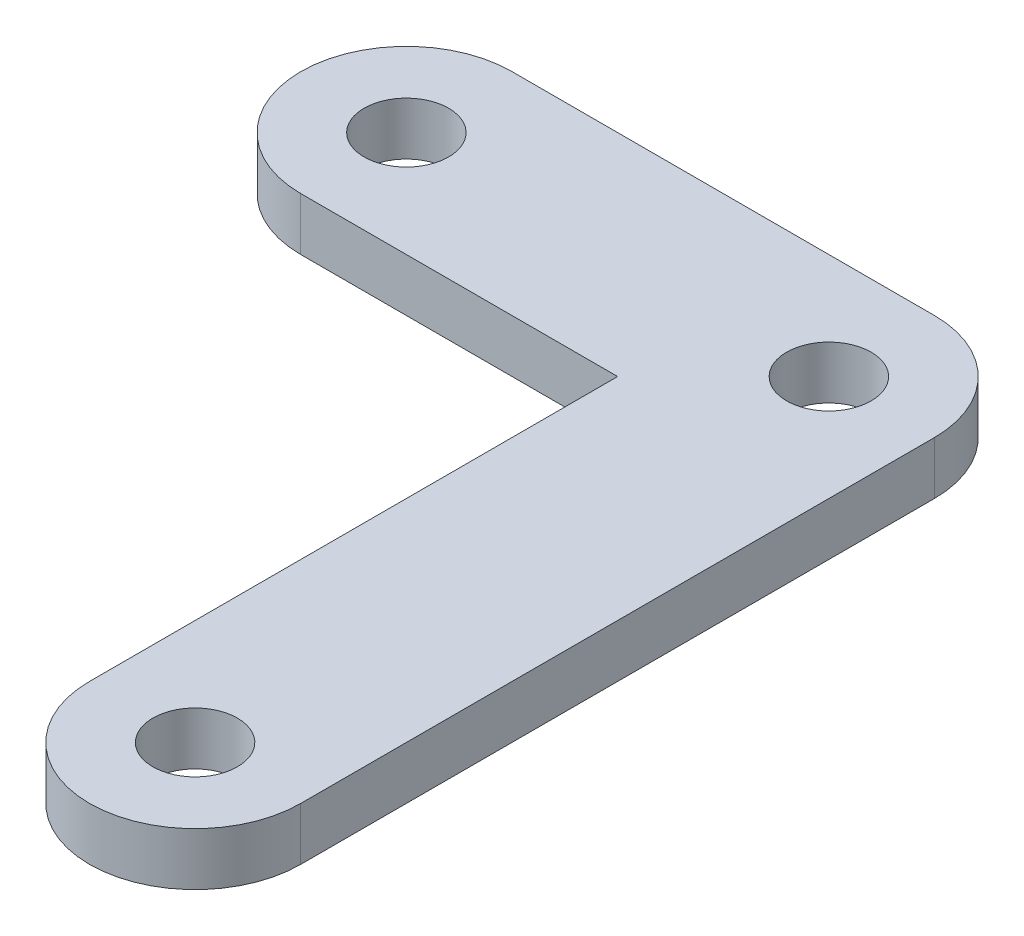
from build123d import *

# Parameters (mm, degrees)
BOSS_EXTRUDE1_DEPTH = 5
SKETCH2_R           = 4
CUT_EXTRUDE1_DEPTH  = 5


with BuildPart() as part:
    # Sketch1 → Boss-Extrude1 (new body)
    with BuildSketch(Plane(origin=(0, 0, 0), x_dir=(1, 0, 0), z_dir=(0, 1, 0))):
        with BuildLine():
            Line((-40, 70), (0, 70))
            ThreePointArc((0, 70), (7.071067812, 67.071067812), (10, 60))
            Line((10, 60), (10, 0))
            ThreePointArc((10, 0), (0, -10), (-10, 0))
            Line((-10, 0), (-10, 50))
            Line((-10, 50), (-40, 50))
            ThreePointArc((-40, 50), (-50, 60), (-40, 70))
        make_face()
    extrude(amount=BOSS_EXTRUDE1_DEPTH)

    # Sketch2 → Cut-Extrude1 (cut)
    with BuildSketch(Plane.XZ):
        Circle(SKETCH2_R)
        with Locations((-40, -60)):
            Circle(SKETCH2_R)
        with Locations((0, -60)):
            Circle(SKETCH2_R)
    extrude(amount=-CUT_EXTRUDE1_DEPTH, mode=Mode.SUBTRACT)


solid = part.part
